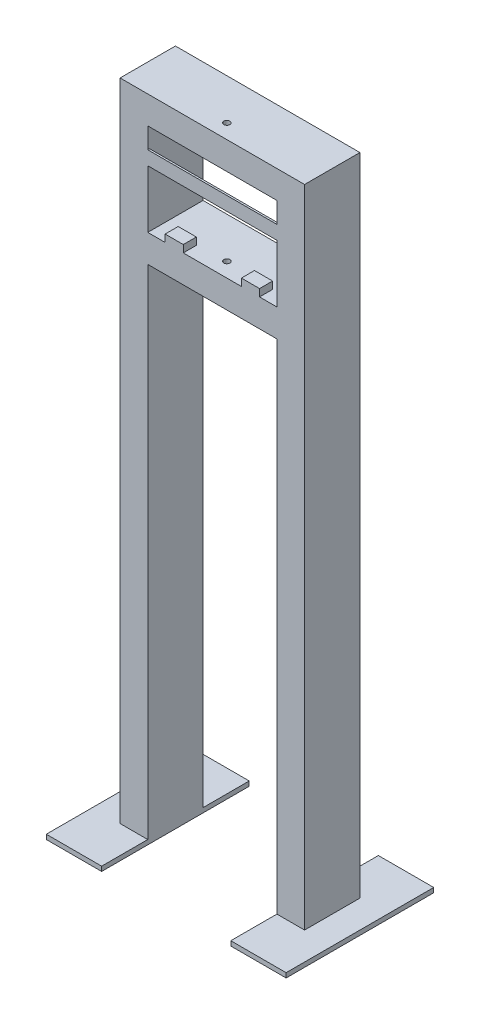
from build123d import *

# Parameters (mm, degrees)
SKETCH1_W             = 76.2
SKETCH1_H             = 203.2
BOSS_EXTRUDE1_DEPTH   = 6.35
BOSS_EXTRUDE1_2_DEPTH = 6.35
SKETCH2_W             = 38.1
SKETCH2_H             = 76.2
BOSS_EXTRUDE2_DEPTH   = 889
SKETCH3_W             = 177.8
SKETCH3_H             = 38.1
BOSS_EXTRUDE3_DEPTH   = 76.2
SKETCH4_R             = 4.2
CUT_EXTRUDE1_DEPTH    = 180
SKETCH5_R             = 2.6
CUT_EXTRUDE2_DEPTH    = 10
SKETCH6_W             = 25
SKETCH6_H             = 18
BOSS_EXTRUDE4_DEPTH   = 10
SKETCH7_W             = 177.8
SKETCH7_H             = 19
BOSS_EXTRUDE5_DEPTH   = 2.54


with BuildPart() as part:
    # Sketch1 → Boss-Extrude1 (new body)
    with BuildSketch(Plane(origin=(0, 0, 0), x_dir=(1, 0, 0), z_dir=(0, 1, 0))):
        with Locations((127, -101.6)):
            Rectangle(SKETCH1_W, SKETCH1_H)
    extrude(amount=BOSS_EXTRUDE1_DEPTH)



with BuildPart() as body_2:
    # Sketch1 → Boss-Extrude1 2 (new body)
    with BuildSketch(Plane(origin=(0, 0, 0), x_dir=(1, 0, 0), z_dir=(0, 1, 0))):
        with Locations((-127, -101.6)):
            Rectangle(SKETCH1_W, SKETCH1_H)
    extrude(amount=BOSS_EXTRUDE1_2_DEPTH)


with BuildPart() as part_1:
    add(part.part)

    add(body_2.part)  # Boss-Extrude2 merges body 2
    # Sketch2 → Boss-Extrude2 (add)
    with BuildSketch(Plane(origin=(0, 6.35, 0), x_dir=(1, 0, 0), z_dir=(0, 1, 0))):
        with Locations((-107.95, -101.6)):
            Rectangle(SKETCH2_W, SKETCH2_H)
        with Locations((107.95, -101.6)):
            Rectangle(SKETCH2_W, SKETCH2_H)
    extrude(amount=BOSS_EXTRUDE2_DEPTH)

    # Sketch3 → Boss-Extrude3 (add)
    with BuildSketch(Plane.XY.offset(139.7)):
        with Locations((0, 876.3)):
            Rectangle(SKETCH3_W, SKETCH3_H)
        with Locations((0, 711.2)):
            Rectangle(SKETCH3_W, SKETCH3_H)
    extrude(amount=-BOSS_EXTRUDE3_DEPTH)

    # Sketch4 → Cut-Extrude1 (cut)
    with BuildSketch(Plane(origin=(0, 895.35, 0), x_dir=(1, 0, 0), z_dir=(0, 1, 0))):
        with Locations(Location((0, -119.7, 0), (0, 0, 270))):
            Circle(SKETCH4_R)
    extrude(amount=-CUT_EXTRUDE1_DEPTH, mode=Mode.SUBTRACT)

    # Sketch5 → Cut-Extrude2 (cut)
    with BuildSketch(Plane.XZ.offset(-857.25)):
        with Locations(Location((-12, 119.7, 0), (0, 0, 270))):
            Circle(SKETCH5_R)
        with Locations(Location((12, 119.7, 0), (0, 0, 90))):
            Circle(SKETCH5_R)
    extrude(amount=-CUT_EXTRUDE2_DEPTH, mode=Mode.SUBTRACT)

    # Sketch6 → Boss-Extrude4 (add)
    with BuildSketch(Plane(origin=(0, 730.25, 0), x_dir=(1, 0, 0), z_dir=(0, 1, 0))):
        with Locations((52.5, -130.7)):
            Rectangle(SKETCH6_W, SKETCH6_H)
        with Locations((-52.5, -130.7)):
            Rectangle(SKETCH6_W, SKETCH6_H)
    extrude(amount=BOSS_EXTRUDE4_DEPTH)

    # Sketch7 → Boss-Extrude5 (add)
    with BuildSketch(Plane.XY.offset(139.7)):
        with Locations((0, 819.25)):
            Rectangle(SKETCH7_W, SKETCH7_H)
    extrude(amount=-BOSS_EXTRUDE5_DEPTH)


solid = part_1.part
